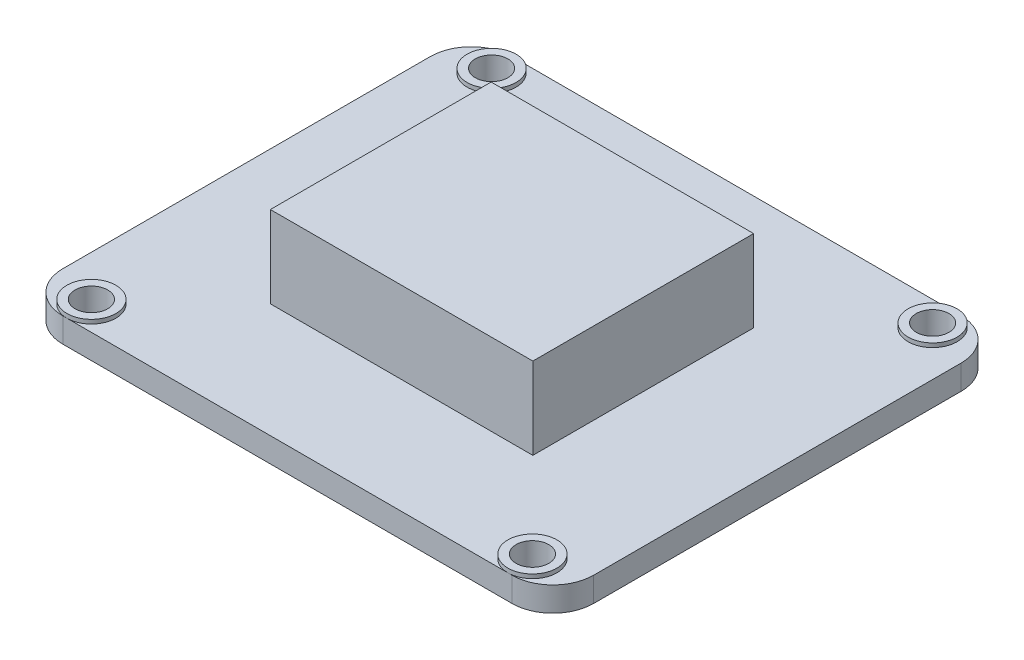
from build123d import *

# Parameters (mm, degrees)
SKETCH_2_W          = 32.137918781
SKETCH_2_H          = 27.033462042
EXTRUDE_1_DEPTH     = 10
SKETCH_2_3_W        = 65
SKETCH_2_3_H        = 55
EXTRUDE_2_DEPTH     = 3
SKETCH_2_5_R        = 2
CUT_EXTRUDE_1_DEPTH = 3
SKETCH_2_6_R        = 2
CUT_EXTRUDE_2_DEPTH = 3
SKETCH_2_7_R        = 2
CUT_EXTRUDE_3_DEPTH = 3
SKETCH_2_8_R        = 2
CUT_EXTRUDE_4_DEPTH = 3
EXTRUDE_START       = 0.5
SKETCH_2_12_R       = 3
SKETCH_2_12_R_2     = 2
EXTRUDE_3_DEPTH     = 0.5
SKETCH_2_15_R       = 3
SKETCH_2_15_R_2     = 2
EXTRUDE_5_DEPTH     = 0.5
SKETCH_2_16_R       = 3
SKETCH_2_16_R_2     = 2
EXTRUDE_6_DEPTH     = 0.5
SKETCH_2_17_R       = 3
SKETCH_2_17_R_2     = 2
EXTRUDE_7_DEPTH     = 0.5
FILLET_3_R          = 5
FILLET_4_R          = 5
FILLET_5_R          = 5
FILLET_6_R          = 5


with BuildPart() as part:
    # 草图2 → 凸台-拉伸1 (new body)
    with BuildSketch(Plane(origin=(0, 0, 0), x_dir=(1, 0, 0), z_dir=(0, 1, 0))):
        with Locations((-1.854305447, 1.088234358)):
            Rectangle(SKETCH_2_W, SKETCH_2_H)
    extrude(amount=EXTRUDE_1_DEPTH)

    # 草图2<3> → 凸台-拉伸2 (add)
    with BuildSketch(Plane(origin=(0, 0, 0), x_dir=(1, 0, 0), z_dir=(0, 1, 0))):
        with Locations((-1.854305446, 1.088234358)):
            Rectangle(SKETCH_2_3_W, SKETCH_2_3_H)
    extrude(amount=-EXTRUDE_2_DEPTH)

    # 草图2<5> → 切除-拉伸1 (cut)
    with BuildSketch(Plane(origin=(0, 0, 0), x_dir=(1, 0, 0), z_dir=(0, 1, 0))):
        with Locations((25.145694554, -23.411765642)):
            Circle(SKETCH_2_5_R)
    extrude(amount=-CUT_EXTRUDE_1_DEPTH, mode=Mode.SUBTRACT)

    # 草图2<6> → 切除-拉伸2 (cut)
    with BuildSketch(Plane(origin=(0, 0, 0), x_dir=(1, 0, 0), z_dir=(0, 1, 0))):
        with Locations((-28.854305446, -23.411765642)):
            Circle(SKETCH_2_6_R)
    extrude(amount=-CUT_EXTRUDE_2_DEPTH, mode=Mode.SUBTRACT)

    # 草图2<7> → 切除-拉伸3 (cut)
    with BuildSketch(Plane(origin=(0, 0, 0), x_dir=(1, 0, 0), z_dir=(0, 1, 0))):
        with Locations((25.145694554, 25.588234358)):
            Circle(SKETCH_2_7_R)
    extrude(amount=-CUT_EXTRUDE_3_DEPTH, mode=Mode.SUBTRACT)

    # 草图2<8> → 切除-拉伸4 (cut)
    with BuildSketch(Plane(origin=(0, 0, 0), x_dir=(1, 0, 0), z_dir=(0, 1, 0))):
        with Locations((-28.854305446, 25.588234358)):
            Circle(SKETCH_2_8_R)
    extrude(amount=-CUT_EXTRUDE_4_DEPTH, mode=Mode.SUBTRACT)

    # 草图2<12> → 凸台-拉伸3 (add)
    with BuildSketch(Plane(origin=(0, 0, 0), x_dir=(1, 0, 0), z_dir=(0, 1, 0)).offset(EXTRUDE_START)):
        with Locations((25.145694554, 25.588234358)):
            Circle(SKETCH_2_12_R)
        with Locations((25.145694554, 25.588234358)):
            Circle(SKETCH_2_12_R_2, mode=Mode.SUBTRACT)
    extrude(amount=-EXTRUDE_3_DEPTH)

    # 草图2<15> → 凸台-拉伸5 (add)
    with BuildSketch(Plane(origin=(0, 0, 0), x_dir=(1, 0, 0), z_dir=(0, 1, 0)).offset(EXTRUDE_START)):
        with Locations((25.145694554, -23.411765642)):
            Circle(SKETCH_2_15_R)
        with Locations((25.145694554, -23.411765642)):
            Circle(SKETCH_2_15_R_2, mode=Mode.SUBTRACT)
    extrude(amount=-EXTRUDE_5_DEPTH)

    # 草图2<16> → 凸台-拉伸6 (add)
    with BuildSketch(Plane(origin=(0, 0, 0), x_dir=(1, 0, 0), z_dir=(0, 1, 0)).offset(EXTRUDE_START)):
        with Locations((-28.854305446, -23.411765642)):
            Circle(SKETCH_2_16_R)
        with Locations((-28.854305446, -23.411765642)):
            Circle(SKETCH_2_16_R_2, mode=Mode.SUBTRACT)
    extrude(amount=-EXTRUDE_6_DEPTH)

    # 草图2<17> → 凸台-拉伸7 (add)
    with BuildSketch(Plane(origin=(0, 0, 0), x_dir=(1, 0, 0), z_dir=(0, 1, 0)).offset(EXTRUDE_START)):
        with Locations((-28.854305446, 25.588234358)):
            Circle(SKETCH_2_17_R)
        with Locations((-28.854305446, 25.588234358)):
            Circle(SKETCH_2_17_R_2, mode=Mode.SUBTRACT)
    extrude(amount=-EXTRUDE_7_DEPTH)

    # 圆角3
    fillet_3_edges = [part.edges().sort_by_distance(p)[0] for p in [
        (30.645694554, -1.5, -28.588234358),
    ]]
    fillet(fillet_3_edges, radius=FILLET_3_R)

    # 圆角4
    fillet_4_edges = [part.edges().sort_by_distance(p)[0] for p in [
        (30.645694554, -1.5, 26.411765642),
    ]]
    fillet(fillet_4_edges, radius=FILLET_4_R)

    # 圆角5
    fillet_5_edges = [part.edges().sort_by_distance(p)[0] for p in [
        (-34.354305446, -1.5, 26.411765642),
    ]]
    fillet(fillet_5_edges, radius=FILLET_5_R)

    # 圆角6
    fillet_6_edges = [part.edges().sort_by_distance(p)[0] for p in [
        (-34.354305446, -1.5, -28.588234358),
    ]]
    fillet(fillet_6_edges, radius=FILLET_6_R)


solid = part.part
